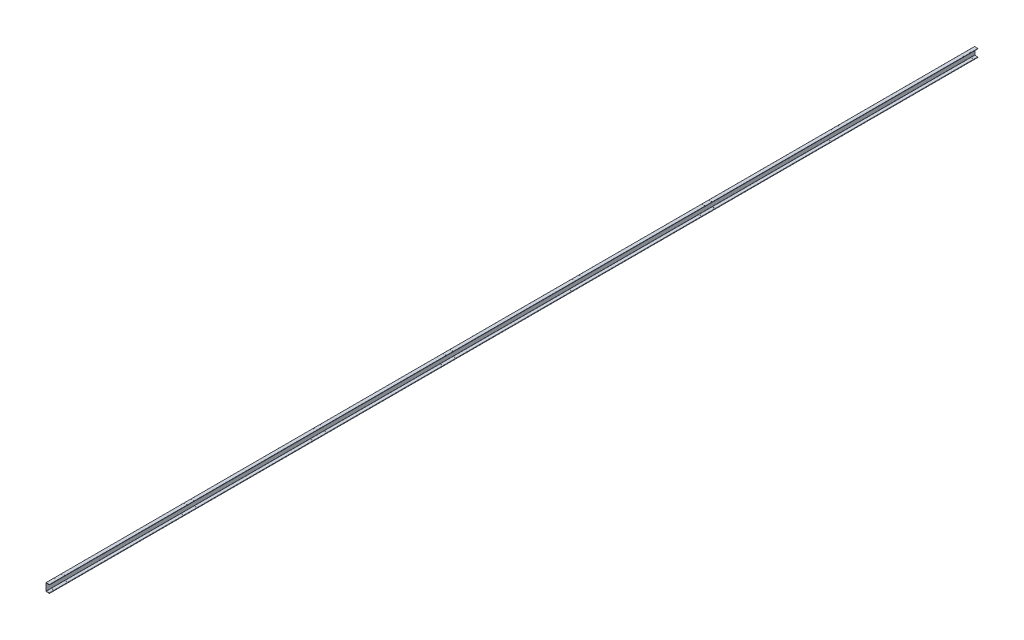
from build123d import *

# Parameters (mm, degrees)
BOSS_EXTRUDE1_DEPTH = 12000
FILLET1_R           = 3
FILLET2_R           = 1
FILLET3_R           = 1
CUT_EXTRUDE4_REACH  = 12002.501
SKETCH4_R           = 3
SKETCH5_R           = 3
CUT_EXTRUDE5_DEPTH  = 10


with BuildPart() as part:
    # Sketch1 → Boss-Extrude1 (new body)
    with BuildSketch(Plane.XY):
        Polygon((0, 50), (0, -50), (45, -50), (45, -44.9), (3, -44.9), (3, 44.9), (45, 44.9), (45, 50), align=None)
    extrude(amount=BOSS_EXTRUDE1_DEPTH)

    # Fillet1
    fillet1_edges = [part.edges().sort_by_distance(p)[0] for p in [
        (45, -44.9, 6000),
        (45, 44.9, 6000),
    ]]
    fillet(fillet1_edges, radius=FILLET1_R)

    # Fillet2
    fillet2_edges = [part.edges().sort_by_distance(p)[0] for p in [
        (45, -50, 6000),
        (0, -50, 6000),
        (0, 50, 6000),
        (45, 50, 6000),
    ]]
    fillet(fillet2_edges, radius=FILLET2_R)

    # Fillet3
    fillet3_edges = [part.edges().sort_by_distance(p)[0] for p in [
        (3, -44.9, 6000),
        (3, 44.9, 6000),
    ]]
    fillet(fillet3_edges, radius=FILLET3_R)

    # Sketch4 → Cut-Extrude4 (cut, up to next)
    with BuildSketch(Plane.XZ.offset(50), mode=Mode.PRIVATE) as cut_extrude4_sk1:
        with Locations(Location((22.5, 50, 0), (0, 0, 270))):
            Circle(SKETCH4_R)
    cut_extrude4_tool1 = extrude(cut_extrude4_sk1.sketch, amount=-CUT_EXTRUDE4_REACH, mode=Mode.PRIVATE) & part.part
    # Sketch4 → Cut-Extrude4 (cut, up to next)
    with BuildSketch(Plane.XZ.offset(50), mode=Mode.PRIVATE) as cut_extrude4_sk2:
        with Locations(Location((22.5, 223, 0), (0, 0, 270))):
            Circle(SKETCH4_R)
    cut_extrude4_tool2 = extrude(cut_extrude4_sk2.sketch, amount=-CUT_EXTRUDE4_REACH, mode=Mode.PRIVATE) & part.part
    # Sketch4 → Cut-Extrude4 (cut, up to next)
    with BuildSketch(Plane.XZ.offset(50), mode=Mode.PRIVATE) as cut_extrude4_sk3:
        with Locations(Location((22.5, 1723, 0), (0, 0, 270))):
            Circle(SKETCH4_R)
    cut_extrude4_tool3 = extrude(cut_extrude4_sk3.sketch, amount=-CUT_EXTRUDE4_REACH, mode=Mode.PRIVATE) & part.part
    # Sketch4 → Cut-Extrude4 (cut, up to next)
    with BuildSketch(Plane.XZ.offset(50), mode=Mode.PRIVATE) as cut_extrude4_sk4:
        with Locations(Location((22.5, 1896, 0), (0, 0, 270))):
            Circle(SKETCH4_R)
    cut_extrude4_tool4 = extrude(cut_extrude4_sk4.sketch, amount=-CUT_EXTRUDE4_REACH, mode=Mode.PRIVATE) & part.part
    # Sketch4 → Cut-Extrude4 (cut, up to next)
    with BuildSketch(Plane.XZ.offset(50), mode=Mode.PRIVATE) as cut_extrude4_sk5:
        with Locations(Location((22.5, 3396, 0), (0, 0, 270))):
            Circle(SKETCH4_R)
    cut_extrude4_tool5 = extrude(cut_extrude4_sk5.sketch, amount=-CUT_EXTRUDE4_REACH, mode=Mode.PRIVATE) & part.part
    # Sketch4 → Cut-Extrude4 (cut, up to next)
    with BuildSketch(Plane.XZ.offset(50), mode=Mode.PRIVATE) as cut_extrude4_sk6:
        with Locations(Location((22.5, 3569, 0), (0, 0, 270))):
            Circle(SKETCH4_R)
    cut_extrude4_tool6 = extrude(cut_extrude4_sk6.sketch, amount=-CUT_EXTRUDE4_REACH, mode=Mode.PRIVATE) & part.part
    # Sketch4 → Cut-Extrude4 (cut, up to next)
    with BuildSketch(Plane.XZ.offset(50), mode=Mode.PRIVATE) as cut_extrude4_sk7:
        with Locations(Location((22.5, 5069, 0), (0, 0, 270))):
            Circle(SKETCH4_R)
    cut_extrude4_tool7 = extrude(cut_extrude4_sk7.sketch, amount=-CUT_EXTRUDE4_REACH, mode=Mode.PRIVATE) & part.part
    # Sketch4 → Cut-Extrude4 (cut, up to next)
    with BuildSketch(Plane.XZ.offset(50), mode=Mode.PRIVATE) as cut_extrude4_sk8:
        with Locations(Location((22.5, 5242, 0), (0, 0, 270))):
            Circle(SKETCH4_R)
    cut_extrude4_tool8 = extrude(cut_extrude4_sk8.sketch, amount=-CUT_EXTRUDE4_REACH, mode=Mode.PRIVATE) & part.part
    # Sketch4 → Cut-Extrude4 (cut, up to next)
    with BuildSketch(Plane.XZ.offset(50), mode=Mode.PRIVATE) as cut_extrude4_sk9:
        with Locations(Location((22.5, 6742, 0), (0, 0, 270))):
            Circle(SKETCH4_R)
    cut_extrude4_tool9 = extrude(cut_extrude4_sk9.sketch, amount=-CUT_EXTRUDE4_REACH, mode=Mode.PRIVATE) & part.part
    # Sketch4 → Cut-Extrude4 (cut, up to next)
    with BuildSketch(Plane.XZ.offset(50), mode=Mode.PRIVATE) as cut_extrude4_sk10:
        with Locations(Location((22.5, 6915, 0), (0, 0, 270))):
            Circle(SKETCH4_R)
    cut_extrude4_tool10 = extrude(cut_extrude4_sk10.sketch, amount=-CUT_EXTRUDE4_REACH, mode=Mode.PRIVATE) & part.part
    # Sketch4 → Cut-Extrude4 (cut, up to next)
    with BuildSketch(Plane.XZ.offset(50), mode=Mode.PRIVATE) as cut_extrude4_sk11:
        with Locations(Location((22.5, 8415, 0), (0, 0, 270))):
            Circle(SKETCH4_R)
    cut_extrude4_tool11 = extrude(cut_extrude4_sk11.sketch, amount=-CUT_EXTRUDE4_REACH, mode=Mode.PRIVATE) & part.part
    # Sketch4 → Cut-Extrude4 (cut, up to next)
    with BuildSketch(Plane.XZ.offset(50), mode=Mode.PRIVATE) as cut_extrude4_sk12:
        with Locations(Location((22.5, 8588, 0), (0, 0, 270))):
            Circle(SKETCH4_R)
    cut_extrude4_tool12 = extrude(cut_extrude4_sk12.sketch, amount=-CUT_EXTRUDE4_REACH, mode=Mode.PRIVATE) & part.part
    # Sketch4 → Cut-Extrude4 (cut, up to next)
    with BuildSketch(Plane.XZ.offset(50), mode=Mode.PRIVATE) as cut_extrude4_sk13:
        with Locations(Location((22.5, 10088, 0), (0, 0, 270))):
            Circle(SKETCH4_R)
    cut_extrude4_tool13 = extrude(cut_extrude4_sk13.sketch, amount=-CUT_EXTRUDE4_REACH, mode=Mode.PRIVATE) & part.part
    # Sketch4 → Cut-Extrude4 (cut, up to next)
    with BuildSketch(Plane.XZ.offset(50), mode=Mode.PRIVATE) as cut_extrude4_sk14:
        with Locations(Location((22.5, 10261, 0), (0, 0, 270))):
            Circle(SKETCH4_R)
    cut_extrude4_tool14 = extrude(cut_extrude4_sk14.sketch, amount=-CUT_EXTRUDE4_REACH, mode=Mode.PRIVATE) & part.part
    # Sketch4 → Cut-Extrude4 (cut, up to next)
    with BuildSketch(Plane.XZ.offset(50), mode=Mode.PRIVATE) as cut_extrude4_sk15:
        with Locations(Location((22.5, 11761, 0), (0, 0, 270))):
            Circle(SKETCH4_R)
    cut_extrude4_tool15 = extrude(cut_extrude4_sk15.sketch, amount=-CUT_EXTRUDE4_REACH, mode=Mode.PRIVATE) & part.part
    # Sketch4 → Cut-Extrude4 (cut, up to next)
    with BuildSketch(Plane.XZ.offset(50), mode=Mode.PRIVATE) as cut_extrude4_sk16:
        with Locations(Location((22.5, 11934, 0), (0, 0, 270))):
            Circle(SKETCH4_R)
    cut_extrude4_tool16 = extrude(cut_extrude4_sk16.sketch, amount=-CUT_EXTRUDE4_REACH, mode=Mode.PRIVATE) & part.part
    add(cut_extrude4_tool1.solids().sort_by_distance((22.5, -50, 50))[0], mode=Mode.SUBTRACT)
    add(cut_extrude4_tool2.solids().sort_by_distance((22.5, -50, 223))[0], mode=Mode.SUBTRACT)
    add(cut_extrude4_tool3.solids().sort_by_distance((22.5, -50, 1723))[0], mode=Mode.SUBTRACT)
    add(cut_extrude4_tool4.solids().sort_by_distance((22.5, -50, 1896))[0], mode=Mode.SUBTRACT)
    add(cut_extrude4_tool5.solids().sort_by_distance((22.5, -50, 3396))[0], mode=Mode.SUBTRACT)
    add(cut_extrude4_tool6.solids().sort_by_distance((22.5, -50, 3569))[0], mode=Mode.SUBTRACT)
    add(cut_extrude4_tool7.solids().sort_by_distance((22.5, -50, 5069))[0], mode=Mode.SUBTRACT)
    add(cut_extrude4_tool8.solids().sort_by_distance((22.5, -50, 5242))[0], mode=Mode.SUBTRACT)
    add(cut_extrude4_tool9.solids().sort_by_distance((22.5, -50, 6742))[0], mode=Mode.SUBTRACT)
    add(cut_extrude4_tool10.solids().sort_by_distance((22.5, -50, 6915))[0], mode=Mode.SUBTRACT)
    add(cut_extrude4_tool11.solids().sort_by_distance((22.5, -50, 8415))[0], mode=Mode.SUBTRACT)
    add(cut_extrude4_tool12.solids().sort_by_distance((22.5, -50, 8588))[0], mode=Mode.SUBTRACT)
    add(cut_extrude4_tool13.solids().sort_by_distance((22.5, -50, 10088))[0], mode=Mode.SUBTRACT)
    add(cut_extrude4_tool14.solids().sort_by_distance((22.5, -50, 10261))[0], mode=Mode.SUBTRACT)
    add(cut_extrude4_tool15.solids().sort_by_distance((22.5, -50, 11761))[0], mode=Mode.SUBTRACT)
    add(cut_extrude4_tool16.solids().sort_by_distance((22.5, -50, 11934))[0], mode=Mode.SUBTRACT)

    # Sketch5 → Cut-Extrude5 (cut)
    with BuildSketch(Plane(origin=(0, 50, 0), x_dir=(1, 0, 0), z_dir=(0, 1, 0))):
        with Locations(Location((37.5, -181.501212025, 0), (0, 0, 270))):
            Circle(SKETCH5_R)
        with Locations(Location((7.5, -181.501212025, 0), (0, 0, 270))):
            Circle(SKETCH5_R)
        with Locations(Location((7.5, -91.501212025, 0), (0, 0, 180))):
            Circle(SKETCH5_R)
        with Locations(Location((37.5, -91.501212025, 0), (0, 0, 180))):
            Circle(SKETCH5_R)
        with Locations(Location((37.5, -1854.501212025, 0), (0, 0, 270))):
            Circle(SKETCH5_R)
        with Locations(Location((7.5, -1854.501212025, 0), (0, 0, 270))):
            Circle(SKETCH5_R)
        with Locations(Location((7.5, -1764.501212025, 0), (0, 0, 180))):
            Circle(SKETCH5_R)
        with Locations(Location((37.5, -1764.501212025, 0), (0, 0, 180))):
            Circle(SKETCH5_R)
        with Locations(Location((37.5, -3527.501212025, 0), (0, 0, 270))):
            Circle(SKETCH5_R)
        with Locations(Location((7.5, -3527.501212025, 0), (0, 0, 270))):
            Circle(SKETCH5_R)
        with Locations(Location((7.5, -3437.501212025, 0), (0, 0, 180))):
            Circle(SKETCH5_R)
        with Locations(Location((37.5, -3437.501212025, 0), (0, 0, 180))):
            Circle(SKETCH5_R)
        with Locations(Location((37.5, -5200.501212025, 0), (0, 0, 270))):
            Circle(SKETCH5_R)
        with Locations(Location((7.5, -5200.501212025, 0), (0, 0, 270))):
            Circle(SKETCH5_R)
        with Locations(Location((7.5, -5110.501212025, 0), (0, 0, 180))):
            Circle(SKETCH5_R)
        with Locations(Location((37.5, -5110.501212025, 0), (0, 0, 180))):
            Circle(SKETCH5_R)
        with Locations(Location((37.5, -6873.501212025, 0), (0, 0, 270))):
            Circle(SKETCH5_R)
        with Locations(Location((7.5, -6873.501212025, 0), (0, 0, 270))):
            Circle(SKETCH5_R)
        with Locations(Location((7.5, -6783.501212025, 0), (0, 0, 180))):
            Circle(SKETCH5_R)
        with Locations(Location((37.5, -6783.501212025, 0), (0, 0, 180))):
            Circle(SKETCH5_R)
        with Locations(Location((37.5, -8546.501212025, 0), (0, 0, 270))):
            Circle(SKETCH5_R)
        with Locations(Location((7.5, -8546.501212025, 0), (0, 0, 270))):
            Circle(SKETCH5_R)
        with Locations(Location((7.5, -8456.501212025, 0), (0, 0, 180))):
            Circle(SKETCH5_R)
        with Locations(Location((37.5, -8456.501212025, 0), (0, 0, 180))):
            Circle(SKETCH5_R)
        with Locations(Location((37.5, -10219.501212025, 0), (0, 0, 270))):
            Circle(SKETCH5_R)
        with Locations(Location((7.5, -10219.501212025, 0), (0, 0, 270))):
            Circle(SKETCH5_R)
        with Locations(Location((7.5, -10129.501212025, 0), (0, 0, 180))):
            Circle(SKETCH5_R)
        with Locations(Location((37.5, -10129.501212025, 0), (0, 0, 180))):
            Circle(SKETCH5_R)
        with Locations(Location((7.5, -11802.501212025, 0), (0, 0, 270))):
            Circle(SKETCH5_R)
        with Locations(Location((37.5, -11802.501212025, 0), (0, 0, 270))):
            Circle(SKETCH5_R)
        with Locations(Location((37.5, -11892.501212025, 0), (0, 0, 180))):
            Circle(SKETCH5_R)
        with Locations(Location((7.5, -11892.501212025, 0), (0, 0, 180))):
            Circle(SKETCH5_R)
    extrude(amount=-CUT_EXTRUDE5_DEPTH, mode=Mode.SUBTRACT)


solid = part.part
